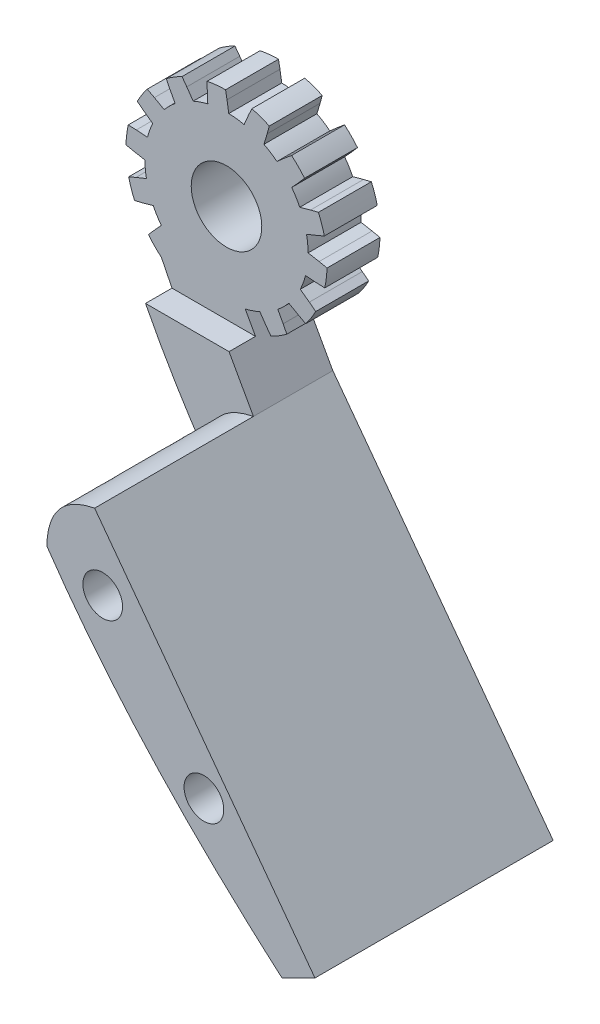
from build123d import *

# Parameters (mm, degrees)
BOSS_EXTRUDE1_DEPTH      = 2
BOSS_EXTRUDE1_DEPTH_BACK = 7
BOSS_EXTRUDE3_DEPTH      = 9
SKETCH6_R                = 4
CUT_EXTRUDE1_DEPTH       = 18
BOSS_EXTRUDE4_DEPTH      = 18
SKETCH8_R                = 2.25
CUT_EXTRUDE2_DEPTH       = 69.863255609
CUT_EXTRUDE3_DEPTH       = 67.431528446
CUT_EXTRUDE3_DEPTH_BACK  = 67.431528446
SKETCH9_W                = 10.323299019
SKETCH9_H                = 27.481333942


with BuildPart() as part:
    # Sketch2 → Boss-Extrude1 (new, two sides: drawn at the far end of the back side and taken through both)
    with BuildSketch(Plane.XY.offset(-BOSS_EXTRUDE1_DEPTH_BACK)):
        with BuildLine():
            Line((17.593003447, 3.447921134), (18.432689254, 3.812129579))
            ThreePointArc((18.432689254, 3.812129579), (18.142308848, 4.822341152), (17.760116965, 5.801513031))
            Line((17.760116965, 5.801513031), (16.871688472, 5.581479263))
            Line((16.871688472, 5.581479263), (15.649099733, 5.241598415))
            ThreePointArc((15.649099733, 5.241598415), (15.22663553, 6.009376293), (14.733410626, 6.733729845))
            Line((14.733410626, 6.733729845), (15.590096731, 7.669855443))
            Line((15.590096731, 7.669855443), (16.188603379, 8.362321932))
            ThreePointArc((16.188603379, 8.362321932), (15.488665299, 9.146499772), (14.719475556, 9.862876308))
            Line((14.719475556, 9.862876308), (14.014498216, 9.279158058))
            Line((14.014498216, 9.279158058), (13.060452596, 8.442474621))
            ThreePointArc((13.060452596, 8.442474621), (12.346699165, 8.950918239), (11.588033655, 9.389535972))
            Line((11.588033655, 9.389535972), (11.95371149, 10.604658163))
            Line((11.95371149, 10.604658163), (12.192497398, 11.488231214))
            ThreePointArc((12.192497398, 11.488231214), (11.221632964, 11.891059284), (10.217792822, 12.202753318))
            Line((10.217792822, 12.202753318), (9.835896044, 11.370963143))
            Line((9.835896044, 11.370963143), (9.33935398, 10.203192533))
            ThreePointArc((9.33935398, 10.203192533), (8.475678941, 10.351598396), (7.601835833, 10.417606691))
            Line((7.601835833, 10.417606691), (7.404078418, 11.671055622))
            Line((7.404078418, 11.671055622), (7.235849109, 12.570732756))
            ThreePointArc((7.235849109, 12.570732756), (6.18634993, 12.512426015), (5.14668224, 12.357702722))
            Line((5.14668224, 12.357702722), (5.163505363, 11.442586867))
            Line((5.163505363, 11.442586867), (5.222813101, 10.175020376))
            ThreePointArc((5.222813101, 10.175020376), (4.380277888, 9.933994883), (3.564332526, 9.614319987))
            Line((3.564332526, 9.614319987), (2.842308143, 10.657834724))
            Line((2.842308143, 10.657834724), (2.300383494, 11.395423851))
            ThreePointArc((2.300383494, 11.395423851), (1.380115753, 10.887530665), (0.510539453, 10.297034891))
            Line((0.510539453, 10.297034891), (0.922750452, 9.479843274))
            Line((0.922750452, 9.479843274), (1.526161366, 8.363537991))
            ThreePointArc((1.526161366, 8.363537991), (0.871640411, 7.780819197), (0.275200782, 7.138776643))
            Line((0.275200782, 7.138776643), (-0.828084785, 7.765676295))
            Line((-0.828084785, 7.765676295), (-1.636369952, 8.195088843))
            ThreePointArc((-1.636369952, 8.195088843), (-2.245135941, 7.338203686), (-2.772390602, 6.42889036))
            Line((-2.772390602, 6.42889036), (-2.04643517, 5.871477804))
            Line((-2.04643517, 5.871477804), (-1.018434012, 5.12753168))
            ThreePointArc((-1.018434012, 5.12753168), (-1.355304806, 4.318534189), (-1.61410652, 3.481288379))
            Line((-1.61410652, 3.481288379), (-2.880134034, 3.567407782))
            Line((-2.880134034, 3.567407782), (-3.794688927, 3.603593329))
            ThreePointArc((-3.794688927, 3.603593329), (-3.971379595, 2.567432815), (-4.051883364, 1.519402593))
            Line((-4.051883364, 1.519402593), (-3.155967876, 1.332171491))
            Line((-3.155967876, 1.332171491), (-1.90698471, 1.107932181))
            ThreePointArc((-1.90698471, 1.107932181), (-1.859483953, 0.232887867), (-1.729388897, -0.633734398))
            Line((-1.729388897, -0.633734398), (-2.907406081, -1.105452248))
            Line((-2.907406081, -1.105452248), (-3.747091888, -1.469660694))
            ThreePointArc((-3.747091888, -1.469660694), (-3.456711482, -2.479872267), (-3.0745196, -3.459044145))
            Line((-3.0745196, -3.459044145), (-2.186091107, -3.239010378))
            Line((-2.186091107, -3.239010378), (-0.963502367, -2.899129529))
            ThreePointArc((-0.963502367, -2.899129529), (-0.541038164, -3.666907408), (-0.047813261, -4.391260959))
            Line((-0.047813261, -4.391260959), (-0.904499365, -5.327386558))
            Line((-0.904499365, -5.327386558), (-1.503006014, -6.019853046))
            ThreePointArc((-1.503006014, -6.019853046), (-0.803067933, -6.804030887), (-0.03387819, -7.520407423))
            Line((-0.03387819, -7.520407423), (0.67109915, -6.936689172))
            Line((0.67109915, -6.936689172), (1.625144769, -6.100005735))
            ThreePointArc((1.625144769, -6.100005735), (2.3388982, -6.608449353), (3.097563711, -7.047067087))
            Line((3.097563711, -7.047067087), (2.731885876, -8.262189278))
            Line((2.731885876, -8.262189278), (2.493099968, -9.145762328))
            ThreePointArc((2.493099968, -9.145762328), (3.463964401, -9.548590398), (4.467804544, -9.860284433))
            Line((4.467804544, -9.860284433), (4.849701322, -9.028494257))
            Line((4.849701322, -9.028494257), (5.346243386, -7.860723648))
            ThreePointArc((5.346243386, -7.860723648), (6.209918425, -8.009129511), (7.083761533, -8.075137806))
            Line((7.083761533, -8.075137806), (7.281518948, -9.328586736))
            Line((7.281518948, -9.328586736), (7.449748257, -10.22826387))
            ThreePointArc((7.449748257, -10.22826387), (8.499247436, -10.16995713), (9.538915126, -10.015233837))
            Line((9.538915126, -10.015233837), (9.522092003, -9.100117982))
            Line((9.522092003, -9.100117982), (9.462784265, -7.83255149))
            ThreePointArc((9.462784265, -7.83255149), (10.305319478, -7.591525998), (11.12126484, -7.271851101))
            Line((11.12126484, -7.271851101), (11.843289223, -8.315365839))
            Line((11.843289223, -8.315365839), (12.385213872, -9.052954966))
            ThreePointArc((12.385213872, -9.052954966), (13.305481612, -8.54506178), (14.175057913, -7.954566005))
            Line((14.175057913, -7.954566005), (13.762846914, -7.137374389))
            Line((13.762846914, -7.137374389), (13.159436, -6.021069105))
            ThreePointArc((13.159436, -6.021069105), (13.813956955, -5.438350311), (14.410396584, -4.796307757))
            Line((14.410396584, -4.796307757), (15.513682151, -5.42320741))
            Line((15.513682151, -5.42320741), (16.321967317, -5.852619957))
            ThreePointArc((16.321967317, -5.852619957), (16.930733307, -4.9957348), (17.457987967, -4.086421474))
            Line((17.457987967, -4.086421474), (16.732032536, -3.529008918))
            Line((16.732032536, -3.529008918), (15.704031377, -2.785062794))
            ThreePointArc((15.704031377, -2.785062794), (16.040902172, -1.976065303), (16.299703886, -1.138819493))
            Line((16.299703886, -1.138819493), (17.565731399, -1.224938896))
            Line((17.565731399, -1.224938896), (18.480286292, -1.261124443))
            ThreePointArc((18.480286292, -1.261124443), (18.656976961, -0.22496393), (18.737480729, 0.823066292))
            Line((18.737480729, 0.823066292), (17.841565242, 1.010297394))
            Line((17.841565242, 1.010297394), (16.592582076, 1.234536705))
            ThreePointArc((16.592582076, 1.234536705), (16.545081318, 2.109581019), (16.414986263, 2.976203284))
            Line((16.414986263, 2.976203284), (17.593003447, 3.447921134))
        make_face()
    extrude(amount=BOSS_EXTRUDE1_DEPTH + BOSS_EXTRUDE1_DEPTH_BACK)

    # Sketch5 → Boss-Extrude3 (add)
    with BuildSketch(Plane.XY.offset(2)):
        with BuildLine():
            Line((34.627961915, -50.407866333), (38.369192873, -48.55177457))
            Line((38.369192873, -48.55177457), (13.393984011, -14.920355903))
            Line((13.393984011, -14.920355903), (9.462784265, -7.83255149))
            Line((9.462784265, -7.83255149), (0.865656202, -2.843190202))
            Line((0.865656202, -2.843190202), (-0.03387819, -7.520407423))
            add(Edge.make_bspline(
                [(34.627961915, -50.407866333), (20.737528927, -38.343464696), (7.957182105, -24.264537371), (-0.03387819, -7.520407423)],
                knots=[0, 0, 0, 0, 1, 1, 1, 1], degree=3))
        make_face()
    extrude(amount=-BOSS_EXTRUDE3_DEPTH)

    # Sketch6 → Cut-Extrude1 (cut)
    with BuildSketch(Plane(origin=(0, 0, -7), x_dir=(-1, 0, 0), z_dir=(0, 0, -1))):
        with Locations((-7.342798683, 1.171234443)):
            Circle(SKETCH6_R)
    extrude(amount=-CUT_EXTRUDE1_DEPTH, mode=Mode.SUBTRACT)

    # Sketch7 → Boss-Extrude4 (add)
    with BuildSketch(Plane.XY.offset(2)):
        with BuildLine():
            Line((34.627961915, -50.407866333), (38.369192873, -48.55177457))
            Line((38.369192873, -48.55177457), (13.393984011, -14.920355903))
            add(Edge.make_bspline(
                [(7.977955023, -21.345123668), (8.112113434, -15.921271934), (13.393984011, -14.920355903)],
                knots=[0, 0, 0, 1, 1, 1], degree=2))
            add(Edge.make_bspline(
                [(7.977955023, -21.345123668), (15.413845314, -32.210109704), (24.739621619, -41.819443715), (34.627961915, -50.407866333)],
                knots=[0.288118642, 0.288118642, 0.288118642, 0.288118642, 1, 1, 1, 1], degree=3))
        make_face()
    extrude(amount=BOSS_EXTRUDE4_DEPTH)

    # Sketch8 → Cut-Extrude2 (cut, through all)
    with BuildSketch(Plane(origin=(0, 0, -7), x_dir=(-1, 0, 0), z_dir=(0, 0, -1))):
        with Locations((-14.312794722, -23.020807584)):
            Circle(SKETCH8_R)
        with Locations((-25.785580409, -37.215397344)):
            Circle(SKETCH8_R)
    extrude(amount=-CUT_EXTRUDE2_DEPTH, mode=Mode.SUBTRACT)

    # Sketch9 → Cut-Extrude3 (cut, two sides: drawn at the far end of the back side and taken through both)
    with BuildSketch(Plane(origin=(0, 0, 0), x_dir=(0, 0, -1), z_dir=(1, 0, 0)).offset(-CUT_EXTRUDE3_DEPTH_BACK)):
        with Locations((-4.16164951, 3.801629666)):
            Rectangle(SKETCH9_W, SKETCH9_H)
    extrude(amount=CUT_EXTRUDE3_DEPTH + CUT_EXTRUDE3_DEPTH_BACK, mode=Mode.SUBTRACT)


solid = part.part
